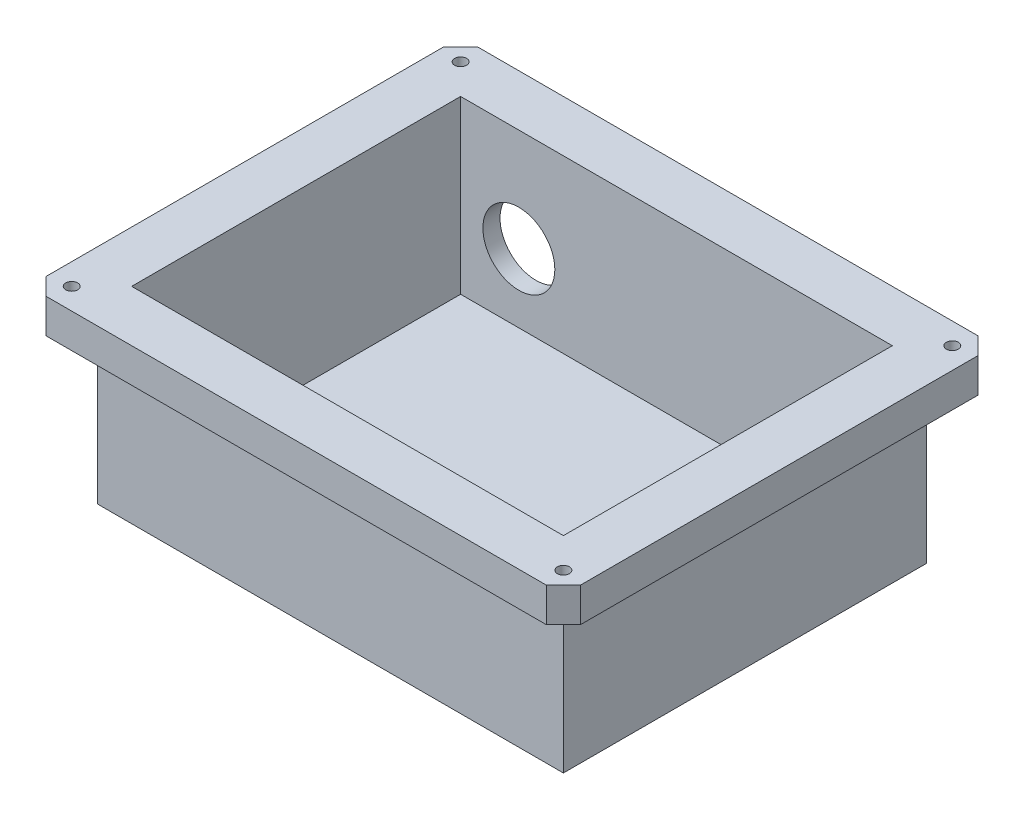
from build123d import *

# Parameters (mm, degrees)
SKETCH1_W                = 136
SKETCH1_H                = 106
SKETCH1_W_2              = 126
SKETCH1_H_2              = 96
BOSS_EXTRUDE1_DEPTH      = 45
SKETCH2_W                = 136
SKETCH2_H                = 106
BOSS_EXTRUDE3_DEPTH      = 5
SKETCH3_R                = 10.5
CUT_EXTRUDE1_DEPTH       = 5
BOSS_EXTRUDE4_DEPTH      = 5
BOSS_EXTRUDE4_DEPTH_BACK = 5
SKETCH4_W                = 156
SKETCH4_H                = 126
SKETCH4_W_2              = 136
SKETCH4_H_2              = 106
SKETCH5_W                = 136
SKETCH5_H                = 106
SKETCH5_W_2              = 126
SKETCH5_H_2              = 96
BOSS_EXTRUDE6_DEPTH      = 5
CHAMFER1_SIZE            = 5
SKETCH6_R                = 1.75
CUT_EXTRUDE2_DEPTH       = 180.97284412


with BuildPart() as part:
    # Sketch1 → Boss-Extrude1 (new body)
    with BuildSketch(Plane(origin=(0, 0, 0), x_dir=(1, 0, 0), z_dir=(0, 1, 0))):
        with Locations((63, 39.392502756)):
            Rectangle(SKETCH1_W, SKETCH1_H)
        with Locations((63, 39.392502756)):
            Rectangle(SKETCH1_W_2, SKETCH1_H_2, mode=Mode.SUBTRACT)
    extrude(amount=BOSS_EXTRUDE1_DEPTH)

    # Sketch2 → Boss-Extrude3 (add)
    with BuildSketch(Plane.XZ):
        with Locations((63, -39.392502756)):
            Rectangle(SKETCH2_W, SKETCH2_H)
    extrude(amount=BOSS_EXTRUDE3_DEPTH)

    # Sketch3 → Cut-Extrude1 (cut)
    with BuildSketch(Plane.XY.offset(-87.392502756)):
        with Locations((17, 20)):
            Circle(SKETCH3_R)
    extrude(amount=-CUT_EXTRUDE1_DEPTH, mode=Mode.SUBTRACT)

    # Sketch4 → Boss-Extrude4 (add, two sides: drawn at the far end of the back side and taken through both)
    with BuildSketch(Plane(origin=(0, 45, 0), x_dir=(1, 0, 0), z_dir=(0, 1, 0)).offset(-BOSS_EXTRUDE4_DEPTH_BACK)):
        with Locations((63, 39.392502756)):
            Rectangle(SKETCH4_W, SKETCH4_H)
        with Locations((63, 39.392502756)):
            Rectangle(SKETCH4_W_2, SKETCH4_H_2, mode=Mode.SUBTRACT)
    extrude(amount=BOSS_EXTRUDE4_DEPTH + BOSS_EXTRUDE4_DEPTH_BACK)

    # Sketch5 → Boss-Extrude6 (add)
    with BuildSketch(Plane(origin=(0, 45, 0), x_dir=(1, 0, 0), z_dir=(0, 1, 0))):
        with Locations((63, 39.392502756)):
            Rectangle(SKETCH5_W, SKETCH5_H)
        with Locations((63, 39.392502756)):
            Rectangle(SKETCH5_W_2, SKETCH5_H_2, mode=Mode.SUBTRACT)
    extrude(amount=BOSS_EXTRUDE6_DEPTH)

    # Chamfer1
    chamfer1_edges = [part.edges().sort_by_distance(p)[0] for p in [
        (-15, 45, 23.607497244),
        (-15, 45, -102.392502756),
        (141, 45, -102.392502756),
        (141, 45, 23.607497244),
    ]]
    chamfer(chamfer1_edges, length=CHAMFER1_SIZE)

    # Sketch6 → Cut-Extrude2 (cut, through all)
    with BuildSketch(Plane.XZ.offset(-40)):
        with Locations(Location((-8.75, 17.357497244, 0), (0, 0, 270))):
            Circle(SKETCH6_R)
        with Locations(Location((-8.75, -96.142502756, 0), (0, 0, 90))):
            Circle(SKETCH6_R)
        with Locations(Location((134.75, -96.142502756, 0), (0, 0, 270))):
            Circle(SKETCH6_R)
        with Locations(Location((134.75, 17.357497244, 0), (0, 0, 90))):
            Circle(SKETCH6_R)
    extrude(amount=-CUT_EXTRUDE2_DEPTH, mode=Mode.SUBTRACT)


solid = part.part
